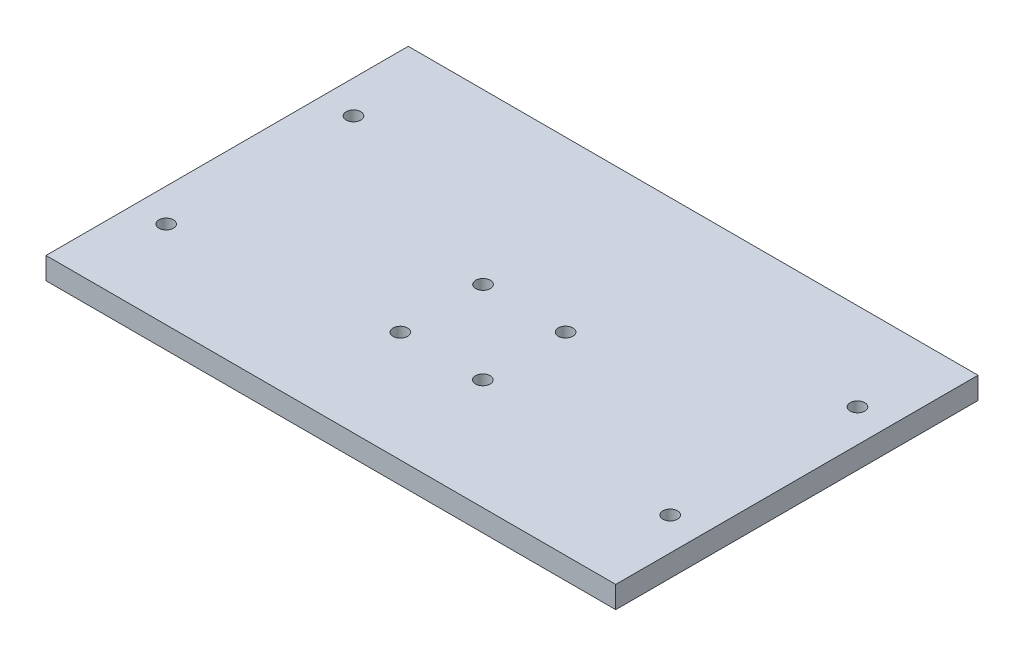
from build123d import *

# Parameters (mm, degrees)
SKETCH2_R           = 5
BOSS_EXTRUDE1_DEPTH = 15


with BuildPart() as part:
    # Sketch2 → Boss-Extrude1 (new body)
    with BuildSketch(Plane(origin=(0, 340, 0), x_dir=(1, 0, 0), z_dir=(0, 1, 0))):
        Polygon((-420.637885724, -681.858342538), (-30.637885724, -681.858342538), (-30.637885724, -455.858342538), (-30.637885724, -433.881423439), (-420.637885724, -433.881423439), (-420.637885724, -455.858342538), align=None)
        with Locations(Location((-53.137885724, -493.881423439, 0), (0, 0, 180))):
            Circle(SKETCH2_R, mode=Mode.SUBTRACT)
        with Locations((-53.137885724, -622.094154379)):
            Circle(SKETCH2_R, mode=Mode.SUBTRACT)
        with Locations((-398.137885724, -493.881423439)):
            Circle(SKETCH2_R, mode=Mode.SUBTRACT)
        with Locations(Location((-398.137885724, -622.094154379, 0), (0, 0, 180))):
            Circle(SKETCH2_R, mode=Mode.SUBTRACT)
        with Locations(Location((-197.384432093, -549.451182731, 0), (0, 0, 180))):
            Circle(SKETCH2_R, mode=Mode.SUBTRACT)
        with Locations(Location((-197.384432093, -606.081360459, 0), (0, 0, 180))):
            Circle(SKETCH2_R, mode=Mode.SUBTRACT)
        with Locations(Location((-253.891339355, -606.081360459, 0), (0, 0, 180))):
            Circle(SKETCH2_R, mode=Mode.SUBTRACT)
        with Locations(Location((-253.891339355, -549.451182731, 0), (0, 0, 180))):
            Circle(SKETCH2_R, mode=Mode.SUBTRACT)
    extrude(amount=BOSS_EXTRUDE1_DEPTH)


solid = part.part
